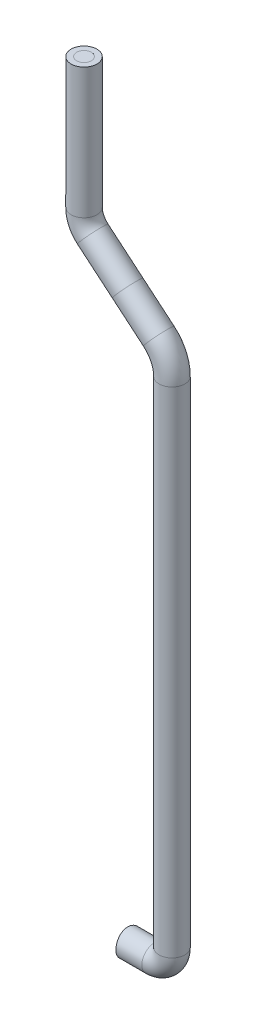
from build123d import *

# Parameters (mm, degrees)
SKETCH_1_R          = 1.05
SKETCH_3_R          = 0.6
SKETCH_4_R          = 0.6
SKETCH_6_R          = 0.6
SKETCH_7_R          = 1.05
SKETCH_7_R_2        = 0.6
CUT_EXTRUDE_1_DEPTH = 10
CUT_EXTRUDE_2_DEPTH = 10


with BuildPart() as part:
    # Sweep 1: sweep along a path in Эскиз2
    with BuildLine(Plane.XY) as sweep_1_path:
        Line((0, 0), (0, 40.180318356))
        ThreePointArc((0, 40.180318356), (-0.281076639, 41.448173141), (-1.071637171, 42.478451685))
        Line((-1.071637171, 42.478451685), (-3.6, 44.600000002))
        Line((-3.6, 44.600000002), (-6.435575219, 46.979330123))
        ThreePointArc((-6.435575219, 46.979330123), (-6.962615574, 47.666182486), (-7.15, 48.511419009))
        Line((-7.15, 48.511419009), (-7.15, 59.119549689))
    # Эскиз1 → Sweep 1 (sweep)
    with BuildSketch(Plane(origin=(0, 0, 0), x_dir=(1, 0, 0), z_dir=(0, 1, 0))):
        Circle(SKETCH_1_R)
    sweep(path=sweep_1_path.line)

    # Sweep 1 2: sweep along a path in Эскиз2<2>
    with BuildLine(Plane.XY) as sweep_1_2_path:
        Line((0, 0), (0, 40.180318356))
        ThreePointArc((0, 40.180318356), (-0.281076639, 41.448173141), (-1.071637171, 42.478451685))
        Line((-1.071637171, 42.478451685), (-3.6, 44.600000002))
        Line((-3.6, 44.600000002), (-6.435575219, 46.979330123))
        ThreePointArc((-6.435575219, 46.979330123), (-6.962615574, 47.666182486), (-7.15, 48.511419009))
        Line((-7.15, 48.511419009), (-7.15, 59.119549689))
    # Эскиз3 → Sweep 1 2 (sweep, cut)
    with BuildSketch(Plane.XZ):
        Circle(SKETCH_3_R)
    sweep(path=sweep_1_2_path.line, mode=Mode.SUBTRACT)

    # По траектории4: sweep along a path in Эскиз5<2>
    with BuildLine(Plane.XY) as sweep_4_path:
        Line((-3.6, -1.4), (-1.4, -1.4))
        ThreePointArc((-1.4, -1.4), (-0.410050506, -0.989949494), (0, 0))
    # Эскиз7 → По траектории4 (sweep)
    with BuildSketch(Plane.XZ):
        Circle(SKETCH_7_R)
        Circle(SKETCH_7_R_2, mode=Mode.SUBTRACT)
    sweep(path=sweep_4_path.line)


with BuildPart() as body_2:
    # По траектории2: sweep along a path in Эскиз2<3>
    with BuildLine(Plane.XY) as sweep_2_path:
        Line((0, 0), (0, 40.180318356))
        ThreePointArc((0, 40.180318356), (-0.281076639, 41.448173141), (-1.071637171, 42.478451685))
        Line((-1.071637171, 42.478451685), (-3.6, 44.600000002))
        Line((-3.6, 44.600000002), (-6.435575219, 46.979330123))
        ThreePointArc((-6.435575219, 46.979330123), (-6.962615574, 47.666182486), (-7.15, 48.511419009))
        Line((-7.15, 48.511419009), (-7.15, 59.119549689))
    # Эскиз4 → По траектории2 (sweep)
    with BuildSketch(Plane.XZ):
        Circle(SKETCH_4_R)
    sweep(path=sweep_2_path.line)

    # По траектории3: sweep along a path in Эскиз5
    with BuildLine(Plane.XY) as sweep_3_path:
        Line((-3.6, -1.4), (-1.4, -1.4))
        ThreePointArc((-1.4, -1.4), (-0.410050506, -0.989949494), (0, 0))
    # Эскиз6 → По траектории3 (sweep)
    with BuildSketch(Plane.XZ):
        Circle(SKETCH_6_R)
    sweep(path=sweep_3_path.line)


with BuildPart() as cut_extrude_1_tool:
    # Эскиз8 → Вырез-Вытянуть1 (new body)
    with BuildSketch(Plane(origin=(0, -2.45, 0), x_dir=(-1, 0, 0), z_dir=(0, -1, 0))):
        with BuildLine():
            ThreePointArc((3.5074106, 1.05), (3.576807827, 0.52703719), (3.6, 0))
            Line((3.6, 0), (3.6, 1.05))
            Line((3.6, 1.05), (3.5074106, 1.05))
        make_face()
    extrude(amount=-CUT_EXTRUDE_1_DEPTH)


with BuildPart() as part_1:
    add(part.part)

    # Вырез-Вытянуть1: cut by cut_extrude_1_tool
    add(cut_extrude_1_tool.part, mode=Mode.SUBTRACT)


with BuildPart() as body_2_1:
    add(body_2.part)

    # Вырез-Вытянуть1: cut by cut_extrude_1_tool
    add(cut_extrude_1_tool.part, mode=Mode.SUBTRACT)


with BuildPart() as cut_extrude_2_tool:
    # Эскиз8<3> → Вырез-Вытянуть2 (new body)
    with BuildSketch(Plane(origin=(0, -2.45, 0), x_dir=(-1, 0, 0), z_dir=(0, -1, 0))):
        with BuildLine():
            Line((3.5074106, -1.05), (3.6, -1.05))
            Line((3.6, -1.05), (3.6, 0))
            ThreePointArc((3.6, 0), (3.576807827, -0.52703719), (3.5074106, -1.05))
        make_face()
    extrude(amount=-CUT_EXTRUDE_2_DEPTH)


with BuildPart() as part_2:
    add(part_1.part)

    # Вырез-Вытянуть2: cut by cut_extrude_2_tool
    add(cut_extrude_2_tool.part, mode=Mode.SUBTRACT)


with BuildPart() as body_2_2:
    add(body_2_1.part)

    # Вырез-Вытянуть2: cut by cut_extrude_2_tool
    add(cut_extrude_2_tool.part, mode=Mode.SUBTRACT)


solid = Compound([part_2.part, body_2_2.part])
